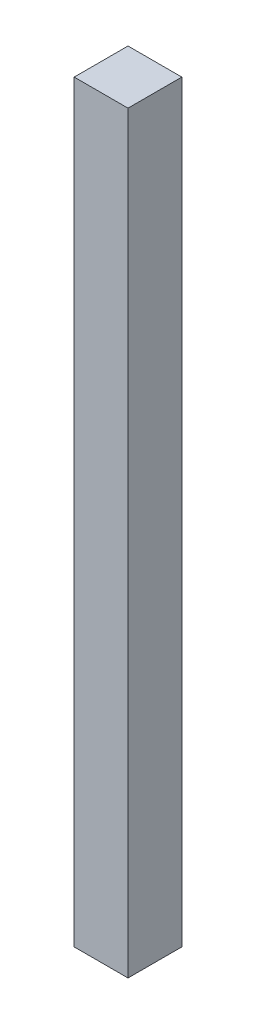
from build123d import *

# Parameters (mm, degrees)
SKETCH1_W           = 20
SKETCH1_H           = 20
BOSS_EXTRUDE1_DEPTH = 280


with BuildPart() as part:
    # Sketch1 → Boss-Extrude1 (new body)
    with BuildSketch(Plane(origin=(0, 0, 0), x_dir=(1, 0, 0), z_dir=(0, 1, 0))):
        Rectangle(SKETCH1_W, SKETCH1_H)
    extrude(amount=BOSS_EXTRUDE1_DEPTH)


solid = part.part
